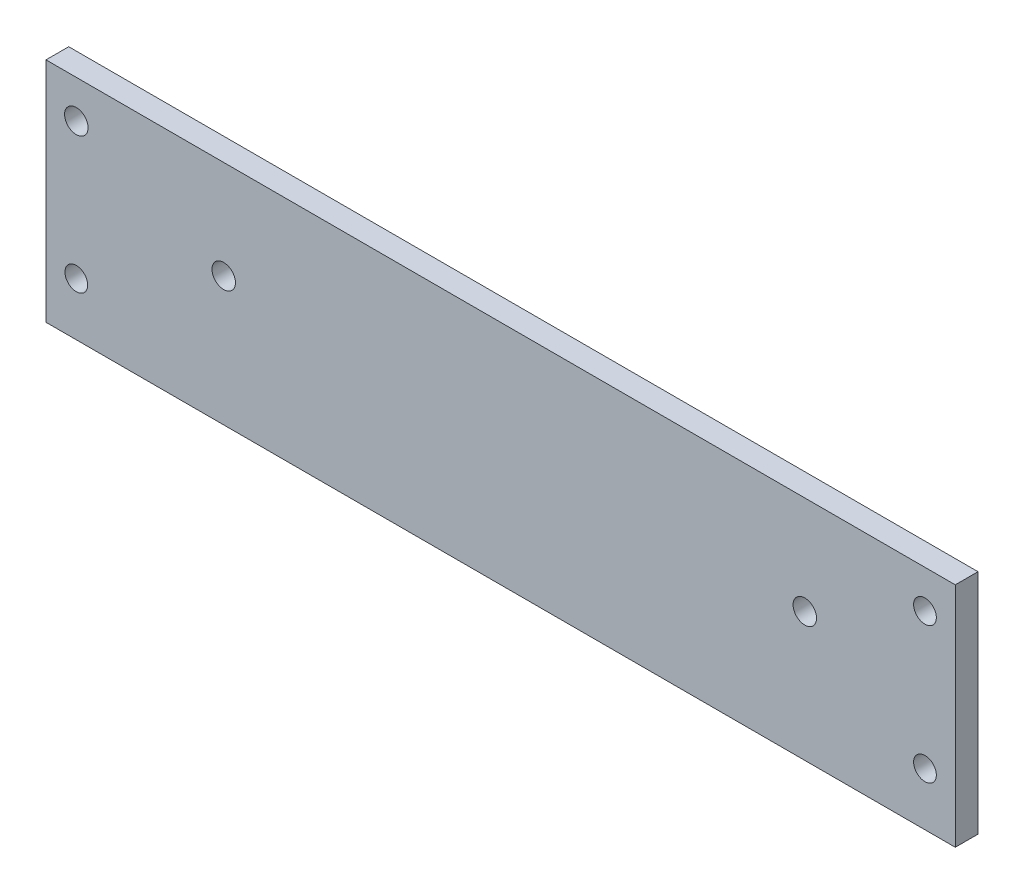
from build123d import *

# Parameters (mm, degrees)
SKETCH_1_W          = 120
SKETCH_1_H          = 30
EXTRUDE_1_DEPTH     = 3
SKETCH_3_R          = 1.5
SKETCH_3_R_2        = 1.55
CUT_EXTRUDE_2_DEPTH = 10
SKETCH_6_R          = 1.5
CUT_EXTRUDE_3_DEPTH = 10
SKETCH_8_R          = 1.55
CUT_EXTRUDE_4_DEPTH = 62.919302322


with BuildPart() as part:
    # 草图1 → 凸台-拉伸1 (new body)
    with BuildSketch(Plane.XY):
        Rectangle(SKETCH_1_W, SKETCH_1_H)
    extrude(amount=EXTRUDE_1_DEPTH)

    # 草图3 → 切除-拉伸2 (cut)
    with BuildSketch(Plane(origin=(0, 0, 0), x_dir=(-1, 0, 0), z_dir=(0, 0, -1))):
        with Locations((-56, 10)):
            Circle(SKETCH_3_R)
        with Locations((56, 10)):
            Circle(SKETCH_3_R_2)
    extrude(amount=-CUT_EXTRUDE_2_DEPTH, mode=Mode.SUBTRACT)

    # 草图6 → 切除-拉伸3 (cut)
    with BuildSketch(Plane.XY.offset(3)):
        with Locations((-56, -8)):
            Circle(SKETCH_6_R)
        with Locations((56, -8)):
            Circle(SKETCH_6_R)
    extrude(amount=-CUT_EXTRUDE_3_DEPTH, mode=Mode.SUBTRACT)

    # 草图8 → 切除-拉伸4 (cut, through all)
    with BuildSketch(Plane(origin=(0, 0, 0), x_dir=(-1, 0, 0), z_dir=(0, 0, -1))):
        with Locations((-40.146260884, 2.02)):
            Circle(SKETCH_8_R)
        with Locations((36.546260884, 2.02)):
            Circle(SKETCH_8_R)
    extrude(amount=-CUT_EXTRUDE_4_DEPTH, mode=Mode.SUBTRACT)


solid = part.part
